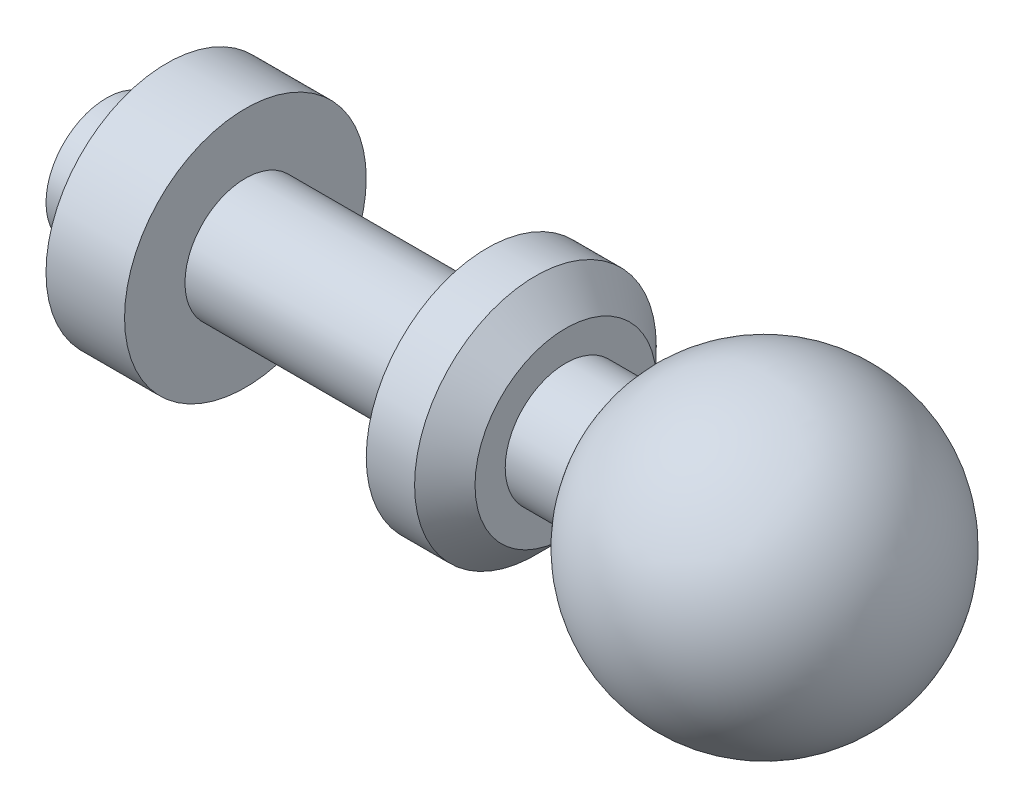
from build123d import *


with BuildPart() as part:
    # Sketch1 → Revolve1 (revolve)
    with BuildSketch(Plane.XY, mode=Mode.PRIVATE) as revolve1_sk:
        with BuildLine():
            Line((0, 0), (0, 10))
            Line((0, 10), (10, 10))
            Line((10, 10), (10, 20))
            Line((10, 20), (23, 20))
            Line((23, 20), (23, 10))
            Line((23, 10), (63, 10))
            Line((63, 10), (63, 20))
            Line((63, 20), (71, 20))
            Line((71, 20), (76, 15))
            Line((76, 15), (76, 10))
            Line((76, 10), (86, 10))
            ThreePointArc((86, 10), (114.020619567, 24.472657823), (133.912878475, 0))
            Line((133.912878475, 0), (0, 0))
        make_face()
    revolve(revolve1_sk.sketch.rotate(Axis((0, 0, 0), (1, 0, 0)), 90), axis=Axis((0, 0, 0), (1, 0, 0)))


solid = part.part
